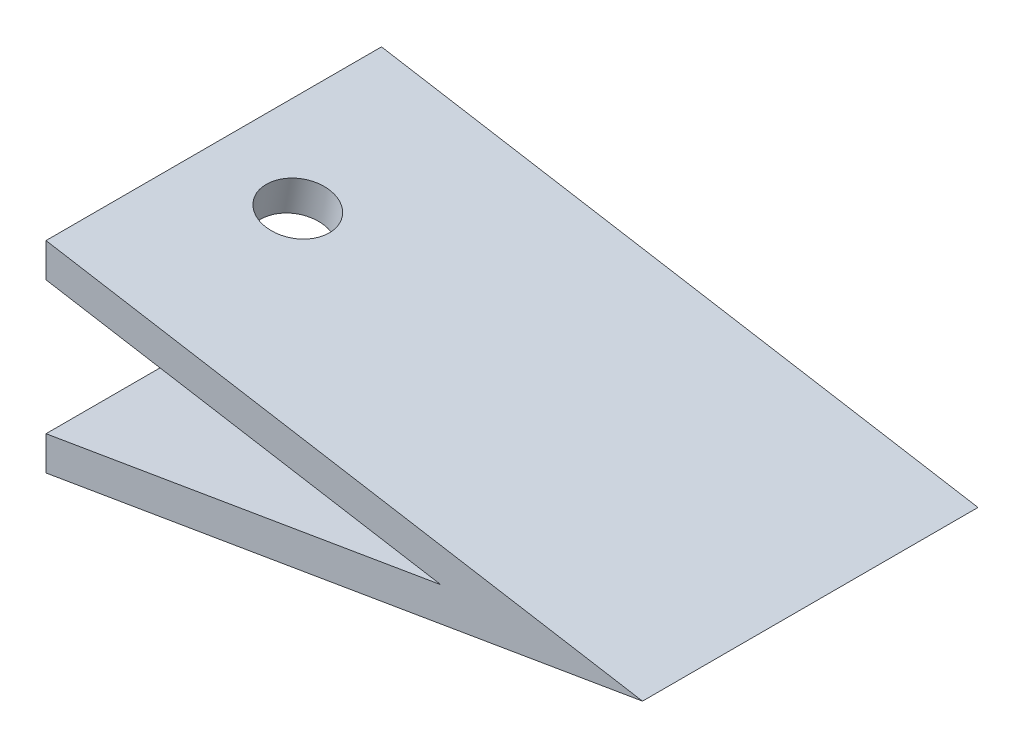
from build123d import *

# Parameters (mm, degrees)
EXTRUDE1_DEPTH = 5
EXTRUDE2_DEPTH = 50
SKETCH3_R      = 4.7625
EXTRUDE3_DEPTH = 101.763138101
EXTRUDE4_REACH = 106.149
SKETCH4_R      = 4.7625
EXTRUDE5_REACH = 106.149
SKETCH5_R      = 4.7625


with BuildPart() as part:
    # Sketch1 → Extrude1 (new body)
    with BuildSketch(Plane.XY):
        Polygon((0, -15), (88.9, 0), (0, 15), align=None)
    extrude(amount=EXTRUDE1_DEPTH)

    # Sketch1<4> → Extrude2 (add)
    with BuildSketch(Plane.XY):
        Polygon((0, 9.929325872), (58.847804665, 0), (0, -9.929325872), (0, -15), (88.9, 0), (0, 15), align=None)
    extrude(amount=EXTRUDE2_DEPTH)

    # Sketch3 → Extrude3 (cut, through all)
    with BuildSketch(Plane.XY.offset(5)):
        with Locations((12.7, 0)):
            Circle(SKETCH3_R)
    extrude(amount=-EXTRUDE3_DEPTH, mode=Mode.SUBTRACT)

    # Sketch4 → Extrude4 (cut, up to next)
    with BuildSketch(Plane(origin=(2.460873919, -14.584779429, 0), x_dir=(0.9860621829168484, 0.16637719621769093, 0), z_dir=(0.16637719621769093, -0.9860621829168484, 0)), mode=Mode.PRIVATE) as extrude4_sk1:
        with Locations((10.204342057, 25)):
            Circle(SKETCH4_R)
    extrude4_tool1 = extrude(extrude4_sk1.sketch, amount=-EXTRUDE4_REACH, mode=Mode.PRIVATE) & part.part
    add(extrude4_tool1.solids().sort_by_distance((12.52299, -12.88701, 25))[0], mode=Mode.SUBTRACT)

    # Sketch5 → Extrude5 (cut, up to next)
    with BuildSketch(Plane(origin=(2.460873919, 14.584779429, 0), x_dir=(0.9860621829168484, -0.16637719621769093, 0), z_dir=(0.16637719621769093, 0.9860621829168484, 0)), mode=Mode.PRIVATE) as extrude5_sk1:
        with Locations((10.204342057, -25)):
            Circle(SKETCH5_R)
    extrude5_tool1 = extrude(extrude5_sk1.sketch, amount=-EXTRUDE5_REACH, mode=Mode.PRIVATE) & part.part
    add(extrude5_tool1.solids().sort_by_distance((12.52299, 12.88701, 25))[0], mode=Mode.SUBTRACT)


solid = part.part
